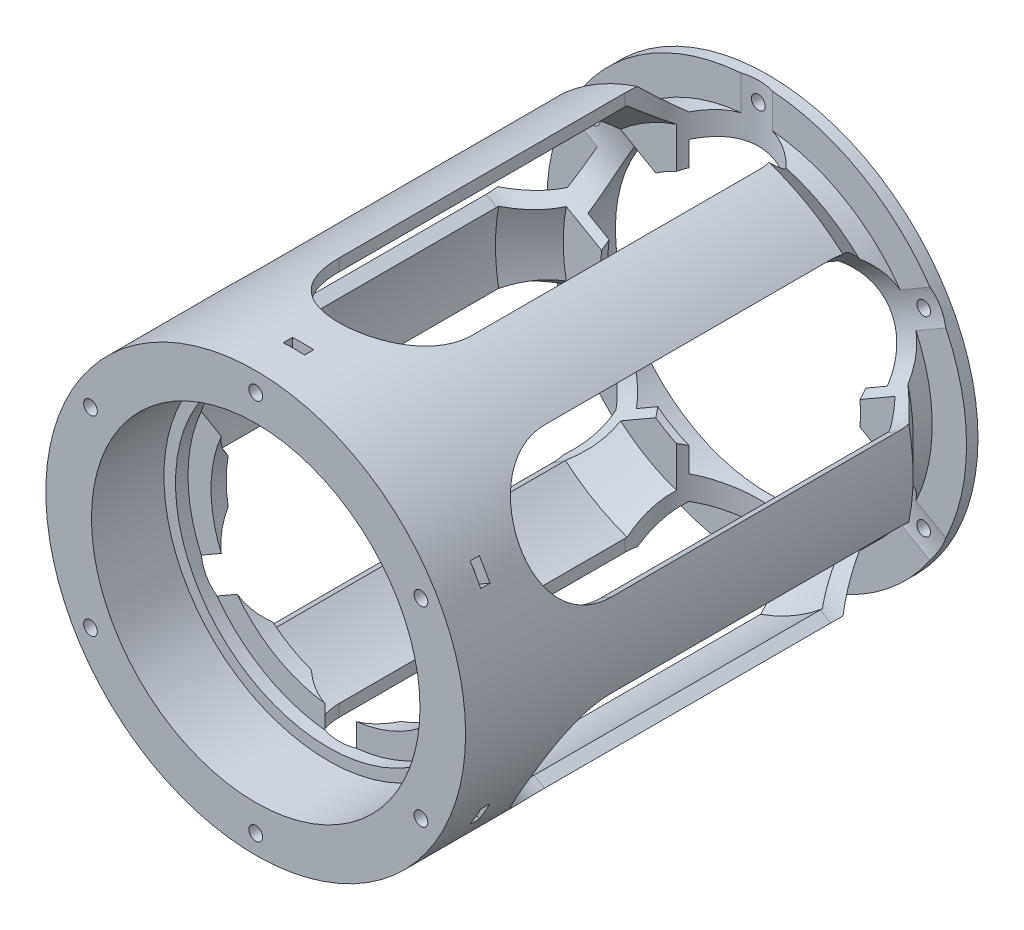
from build123d import *

# Parameters (mm, degrees)
SKETCH3_R           = 1.8
CUT_EXTRUDE1_DEPTH  = 156.180921508
BOSS_EXTRUDE1_START = 5
BOSS_EXTRUDE1_DEPTH = 5
SKETCH5_W           = 5.6
SKETCH5_H           = 11.131010483
CUT_EXTRUDE2_DEPTH  = 2.4
CUT_EXTRUDE3_DEPTH  = 156.180921579
CIRPATTERN1_COUNT   = 3


with BuildPart() as part:
    # Sketch2 → Revolve1 (revolve)
    with BuildSketch(Plane(origin=(0, 0, 0), x_dir=(1, 0, 0), z_dir=(0, 1, 0))):
        Polygon((55, 0), (40.025, 0), (40.025, -8), (34, -8), (34, -9.8), (43.902605835, -9.8), (52, -19.465965678), (52, -55.448945518), (52, -106), (50, -108), (34, -108), (34, -112), (40.025, -112), (40.025, -115.28), (43.05, -115.28), (43.05, -134.28), (55, -134.28), (55, -111), (55, -57), (55, -17), (46, -8), (46, -3), (55, -3), align=None)
    revolve(axis=Axis((0, 0, 164.117462422), (0, 0, -1)))

    # Sketch3 → Cut-Extrude1 (cut, through all)
    with BuildSketch(Plane.XY.offset(134.28)):
        with Locations(Location((0, 50, 0), (0, 0, 248.096792535))):
            Circle(SKETCH3_R)
        with Locations(Location((43.301270189, 25, 0), (0, 0, 212.603778554))):
            Circle(SKETCH3_R)
        with Locations(Location((43.301270189, -25, 0), (0, 0, 147.396221446))):
            Circle(SKETCH3_R)
        with Locations(Location((0, -50, 0), (0, 0, 111.903207465))):
            Circle(SKETCH3_R)
        with Locations(Location((-43.301270189, -25, 0), (0, 0, 31.366950374))):
            Circle(SKETCH3_R)
        with Locations(Location((-43.301270189, 25, 0), (0, 0, 328.633049626))):
            Circle(SKETCH3_R)
    extrude(amount=-CUT_EXTRUDE1_DEPTH, mode=Mode.SUBTRACT)

    # Sketch4 → Boss-Extrude1 (add)
    with BuildSketch(Plane.XY.offset(115.28).offset(BOSS_EXTRUDE1_START)):
        with BuildLine():
            ThreePointArc((2.45, 42.980228012), (0, 43.05), (-2.45, 42.980228012))
            Line((-2.45, 42.980228012), (-2.45, 39.949945244))
            ThreePointArc((-2.45, 39.949945244), (0, 40.025), (2.45, 39.949945244))
            Line((2.45, 39.949945244), (2.45, 42.980228012))
        make_face()
    extrude(amount=-BOSS_EXTRUDE1_DEPTH)

    # Sketch5 → Cut-Extrude2 (cut)
    with BuildSketch(Plane.XY.offset(124.28)):
        with Locations((0, 52.765505242)):
            Rectangle(SKETCH5_W, SKETCH5_H)
        Polygon((51.916136906, 26.740634111), (49.116136906, 31.590376372), (39.476399059, 26.024871131), (42.276399059, 21.175128869), align=None)
        Polygon((49.116136906, -31.590376372), (51.916136906, -26.740634111), (42.276399059, -21.175128869), (39.476399059, -26.024871131), align=None)
        with Locations((0, -52.765505242)):
            Rectangle(SKETCH5_W, SKETCH5_H)
        Polygon((-51.916136906, -26.740634111), (-49.116136906, -31.590376372), (-39.476399059, -26.024871131), (-42.276399059, -21.175128869), align=None)
        Polygon((-49.116136906, 31.590376372), (-51.916136906, 26.740634111), (-42.276399059, 21.175128869), (-39.476399059, 26.024871131), align=None)
    extrude(amount=-CUT_EXTRUDE2_DEPTH, mode=Mode.SUBTRACT)

    # Sketch6 → Cut-Extrude3 (cut, symmetric)
    with BuildSketch(Plane(origin=(0, 0, 0), x_dir=(1, 0, 0), z_dir=(0, 1, 0))):
        with BuildLine():
            Line((-17.5, -20), (-17.5, -95))
            ThreePointArc((-17.5, -95), (0, -112.5), (17.5, -95))
            Line((17.5, -95), (17.5, -20))
            ThreePointArc((17.5, -20), (0, -2.5), (-17.5, -20))
        make_face()
    cut_extrude3 = extrude(amount=CUT_EXTRUDE3_DEPTH, both=True, mode=Mode.SUBTRACT)

    # CirPattern1: Cut-Extrude3 ×3 about axis
    cirpattern1_axis = Axis((0, 0, 0), (0, 0, 1))
    for i in range(1, CIRPATTERN1_COUNT):
        add(cut_extrude3.rotate(cirpattern1_axis, i * 360 / CIRPATTERN1_COUNT), mode=Mode.SUBTRACT)


solid = part.part
